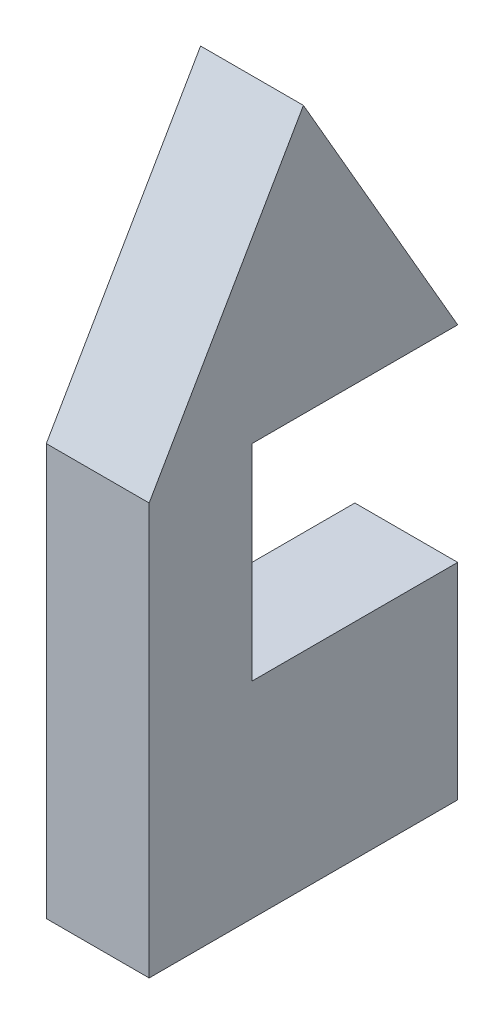
from build123d import *

# Parameters (mm, degrees)
EXTRUDE_2_DEPTH = 1


with BuildPart() as part:
    # 草图2 → 凸台-拉伸2 (new body)
    with BuildSketch(Plane(origin=(0, 0, 0), x_dir=(0, 0, -1), z_dir=(1, 0, 0))):
        Polygon((-2.604410535, 1.272378682), (-0.604410535, 1.272378682), (-0.604410535, -0.727621318), (-3.604410535, -0.727621318), (-3.604410535, 1.272378682), (-3.604410535, 3.272378682), (-2.104410535, 5.870454893), (-0.604410535, 3.272378682), (-2.604410535, 3.272378682), align=None)
    extrude(amount=EXTRUDE_2_DEPTH)


solid = part.part
